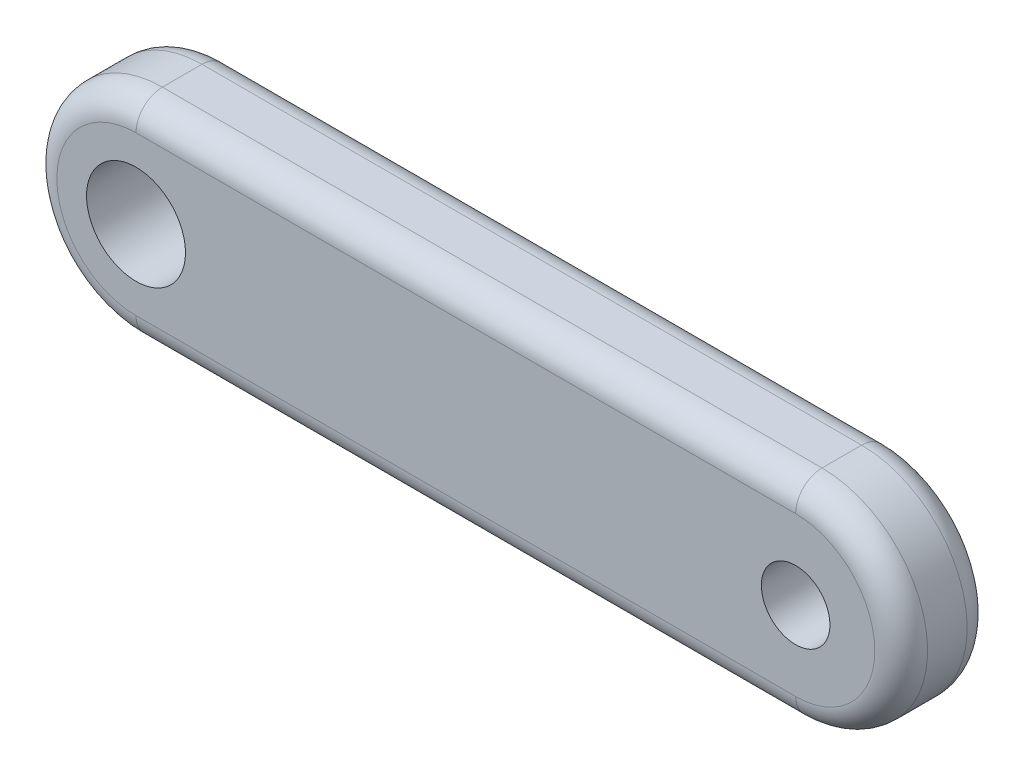
from build123d import *

# Parameters (mm, degrees)
SKETCH1_R           = 2.38125
SKETCH1_R_2         = 1.651
BOSS_EXTRUDE1_DEPTH = 4.445
FILLET1_R           = 1.27


with BuildPart() as part:
    # Sketch1 → Boss-Extrude1 (new body)
    with BuildSketch(Plane.XY):
        with BuildLine():
            Line((0, 5.08), (31.75, 5.08))
            ThreePointArc((31.75, 5.08), (36.83, 0), (31.75, -5.08))
            Line((31.75, -5.08), (0, -5.08))
            ThreePointArc((0, -5.08), (-5.08, 0), (0, 5.08))
        make_face()
        Circle(SKETCH1_R, mode=Mode.SUBTRACT)
        with Locations((31.75, 0)):
            Circle(SKETCH1_R_2, mode=Mode.SUBTRACT)
    extrude(amount=BOSS_EXTRUDE1_DEPTH)

    # Fillet1
    fillet1_edges = [part.edges().sort_by_distance(p)[0] for p in [
        (36.83, 0, 4.445),
        (15.875, 5.08, 4.445),
        (-5.08, 0, 4.445),
        (15.875, 5.08, 0),
        (36.83, 0, 0),
        (15.875, -5.08, 0),
        (-5.08, 0, 0),
        (15.875, -5.08, 4.445),
    ]]
    fillet(fillet1_edges, radius=FILLET1_R)


solid = part.part
